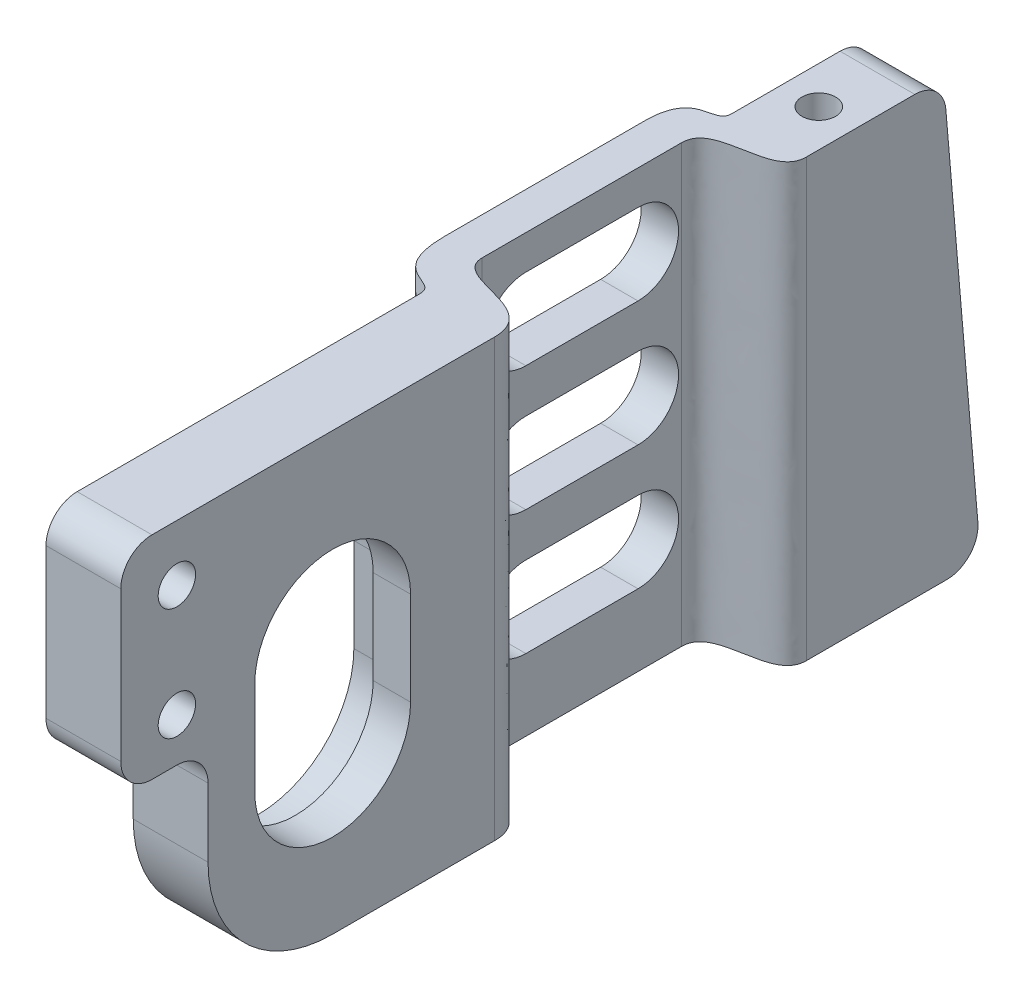
from build123d import *

# Parameters (mm, degrees)
BOSS_EXTRUDE1_DEPTH = 35
CUT_EXTRUDE1_REACH  = 79.891
SKETCH4_R           = 1.5
SKETCH4_W           = 7
SKETCH4_H           = 18
SKETCH7_R           = 3.25
CUT_EXTRUDE2_DEPTH  = 3
SKETCH10_R          = 1.35
CUT_EXTRUDE3_DEPTH  = 10
CUT_EXTRUDE4_START  = -10
SKETCH11_R          = 1.35
CUT_EXTRUDE4_DEPTH  = 10
FILLET1_R           = 2.5
FILLET2_R           = 10


with BuildPart() as part:
    # Sketch3 → Boss-Extrude1 (new body)
    with BuildSketch(Plane(origin=(0, 0, 0), x_dir=(1, 0, 0), z_dir=(0, 1, 0))):
        with BuildLine():
            Line((0, 69), (-6, 69))
            Line((-6, 69), (-6, 55))
            add(Edge.make_bspline(
                [(-9, 51), (-9, 55.307083004), (-6, 53.455748632), (-6, 55)],
                knots=[0, 0, 0, 0, 1, 1, 1, 1], degree=3))
            Line((-9, 51), (-9, 35))
            add(Edge.make_bspline(
                [(-9, 35), (-9, 30.102050716), (-6, 31.687720833), (-6, 30)],
                knots=[0, 0, 0, 0, 1, 1, 1, 1], degree=3))
            Line((-6, 30), (-6, 0))
            Line((-6, 0), (0, 0))
            Line((0, 0), (0, 30))
            add(Edge.make_bspline(
                [(-6, 35), (-6, 32.33641875), (0, 33.956398937), (0, 30)],
                knots=[0, 0, 0, 0, 1, 1, 1, 1], degree=3))
            Line((-6, 35), (-6, 51))
            add(Edge.make_bspline(
                [(0, 55), (0, 52.08873611), (-6, 53.842765247), (-6, 51)],
                knots=[0, 0, 0, 0, 1, 1, 1, 1], degree=3))
            Line((0, 55), (0, 69))
        make_face()
    extrude(amount=BOSS_EXTRUDE1_DEPTH)

    # Sketch4 → Cut-Extrude1 (cut, up to next)
    with BuildSketch(Plane.ZY.offset(9), mode=Mode.PRIVATE) as cut_extrude1_sk1:
        with Locations((-4.5, 30.5)):
            Circle(SKETCH4_R)
    cut_extrude1_tool1 = extrude(cut_extrude1_sk1.sketch, amount=-CUT_EXTRUDE1_REACH, mode=Mode.PRIVATE) & part.part
    # Sketch4 → Cut-Extrude1 (cut, up to next)
    with BuildSketch(Plane.ZY.offset(9), mode=Mode.PRIVATE) as cut_extrude1_sk2:
        with Locations((-4.5, 21.5)):
            Circle(SKETCH4_R)
    cut_extrude1_tool2 = extrude(cut_extrude1_sk2.sketch, amount=-CUT_EXTRUDE1_REACH, mode=Mode.PRIVATE) & part.part
    # Sketch4 → Cut-Extrude1 (cut, up to next)
    with BuildSketch(Plane.ZY.offset(9), mode=Mode.PRIVATE) as cut_extrude1_sk3:
        Polygon((-69, 35), (-66, 35), (-69, 0), align=None)
    cut_extrude1_tool3 = extrude(cut_extrude1_sk3.sketch, amount=-CUT_EXTRUDE1_REACH, mode=Mode.PRIVATE) & part.part
    # Sketch4 → Cut-Extrude1 (cut, up to next)
    with BuildSketch(Plane.ZY.offset(9), mode=Mode.PRIVATE) as cut_extrude1_sk4:
        with BuildLine():
            Line((-47.5, 32.25), (-38.5, 32.25))
            ThreePointArc((-38.5, 32.25), (-35.25, 29), (-38.5, 25.75))
            Line((-38.5, 25.75), (-47.5, 25.75))
            ThreePointArc((-47.5, 25.75), (-50.75, 29), (-47.5, 32.25))
        make_face()
    cut_extrude1_tool4 = extrude(cut_extrude1_sk4.sketch, amount=-CUT_EXTRUDE1_REACH, mode=Mode.PRIVATE) & part.part
    # Sketch4 → Cut-Extrude1 (cut, up to next)
    with BuildSketch(Plane.ZY.offset(9), mode=Mode.PRIVATE) as cut_extrude1_sk5:
        with BuildLine():
            Line((-47.5, 22.25), (-38.5, 22.25))
            ThreePointArc((-38.5, 22.25), (-35.25, 19), (-38.5, 15.75))
            Line((-38.5, 15.75), (-47.5, 15.75))
            ThreePointArc((-47.5, 15.75), (-50.75, 19), (-47.5, 22.25))
        make_face()
    cut_extrude1_tool5 = extrude(cut_extrude1_sk5.sketch, amount=-CUT_EXTRUDE1_REACH, mode=Mode.PRIVATE) & part.part
    # Sketch4 → Cut-Extrude1 (cut, up to next)
    with BuildSketch(Plane.ZY.offset(9), mode=Mode.PRIVATE) as cut_extrude1_sk6:
        with BuildLine():
            Line((-47.5, 12.25), (-38.5, 12.25))
            ThreePointArc((-38.5, 12.25), (-35.25, 9), (-38.5, 5.75))
            Line((-38.5, 5.75), (-47.5, 5.75))
            ThreePointArc((-47.5, 5.75), (-50.75, 9), (-47.5, 12.25))
        make_face()
    cut_extrude1_tool6 = extrude(cut_extrude1_sk6.sketch, amount=-CUT_EXTRUDE1_REACH, mode=Mode.PRIVATE) & part.part
    # Sketch4 → Cut-Extrude1 (cut, up to next)
    with BuildSketch(Plane.ZY.offset(9), mode=Mode.PRIVATE) as cut_extrude1_sk7:
        with Locations((-3.5, 9)):
            Rectangle(SKETCH4_W, SKETCH4_H)
    cut_extrude1_tool7 = extrude(cut_extrude1_sk7.sketch, amount=-CUT_EXTRUDE1_REACH, mode=Mode.PRIVATE) & part.part
    # Sketch4 → Cut-Extrude1 (cut, up to next)
    with BuildSketch(Plane.ZY.offset(9), mode=Mode.PRIVATE) as cut_extrude1_sk8:
        with BuildLine():
            Line((-10.75, 20.5), (-10.75, 13))
            ThreePointArc((-10.75, 13), (-17, 6.75), (-23.25, 13))
            Line((-23.25, 13), (-23.25, 20.5))
            ThreePointArc((-23.25, 20.5), (-17, 26.75), (-10.75, 20.5))
        make_face()
    cut_extrude1_tool8 = extrude(cut_extrude1_sk8.sketch, amount=-CUT_EXTRUDE1_REACH, mode=Mode.PRIVATE) & part.part
    add(cut_extrude1_tool1.solids().sort_by_distance((-9, 30.5, -4.5))[0], mode=Mode.SUBTRACT)
    add(cut_extrude1_tool2.solids().sort_by_distance((-9, 21.5, -4.5))[0], mode=Mode.SUBTRACT)
    add(cut_extrude1_tool3.solids().sort_by_distance((-9, 23.333333, -68))[0], mode=Mode.SUBTRACT)
    add(cut_extrude1_tool4.solids().sort_by_distance((-9, 29, -43))[0], mode=Mode.SUBTRACT)
    add(cut_extrude1_tool5.solids().sort_by_distance((-9, 19, -43))[0], mode=Mode.SUBTRACT)
    add(cut_extrude1_tool6.solids().sort_by_distance((-9, 9, -43))[0], mode=Mode.SUBTRACT)
    add(cut_extrude1_tool7.solids().sort_by_distance((-9, 9, -3.5))[0], mode=Mode.SUBTRACT)
    add(cut_extrude1_tool8.solids().sort_by_distance((-9, 16.75, -17))[0], mode=Mode.SUBTRACT)

    # Sketch7 → Cut-Extrude2 (cut)
    with BuildSketch(Plane.ZY.offset(6)):
        with Locations((-4.5, 30.5)):
            Circle(SKETCH7_R)
        with Locations((-4.5, 21.5)):
            Circle(SKETCH7_R)
        with BuildLine():
            Line((-9.3, 20.5), (-9.3, 13))
            ThreePointArc((-9.3, 13), (-17, 5.3), (-24.7, 13))
            Line((-24.7, 13), (-24.7, 20.5))
            ThreePointArc((-24.7, 20.5), (-17, 28.2), (-9.3, 20.5))
        make_face()
    extrude(amount=-CUT_EXTRUDE2_DEPTH, mode=Mode.SUBTRACT)

    # Sketch10 → Cut-Extrude3 (cut)
    with BuildSketch(Plane.XZ):
        with Locations(Location((-3, -59, 0), (0, 0, 270))):
            Circle(SKETCH10_R)
        with Locations(Location((-3, -26, 0), (0, 0, 270))):
            Circle(SKETCH10_R)
    extrude(amount=-CUT_EXTRUDE3_DEPTH, mode=Mode.SUBTRACT)

    # Sketch11 → Cut-Extrude4 (cut)
    with BuildSketch(Plane(origin=(0, 35, 0), x_dir=(1, 0, 0), z_dir=(0, 1, 0)).offset(CUT_EXTRUDE4_START)):
        with Locations(Location((-3, 59, 0), (0, 0, 90))):
            Circle(SKETCH11_R)
    extrude(amount=CUT_EXTRUDE4_DEPTH, mode=Mode.SUBTRACT)

    # Fillet1
    fillet1_edges = [part.edges().sort_by_distance(p)[0] for p in [
        (-3, 0, -69),
        (-3, 35, 0),
        (-3, 35, -66),
        (-3, 18, 0),
        (-3, 18, -7),
    ]]
    fillet(fillet1_edges, radius=FILLET1_R)

    # Fillet2
    fillet2_edges = [part.edges().sort_by_distance(p)[0] for p in [
        (-3, 0, -7),
    ]]
    fillet(fillet2_edges, radius=FILLET2_R)


solid = part.part
